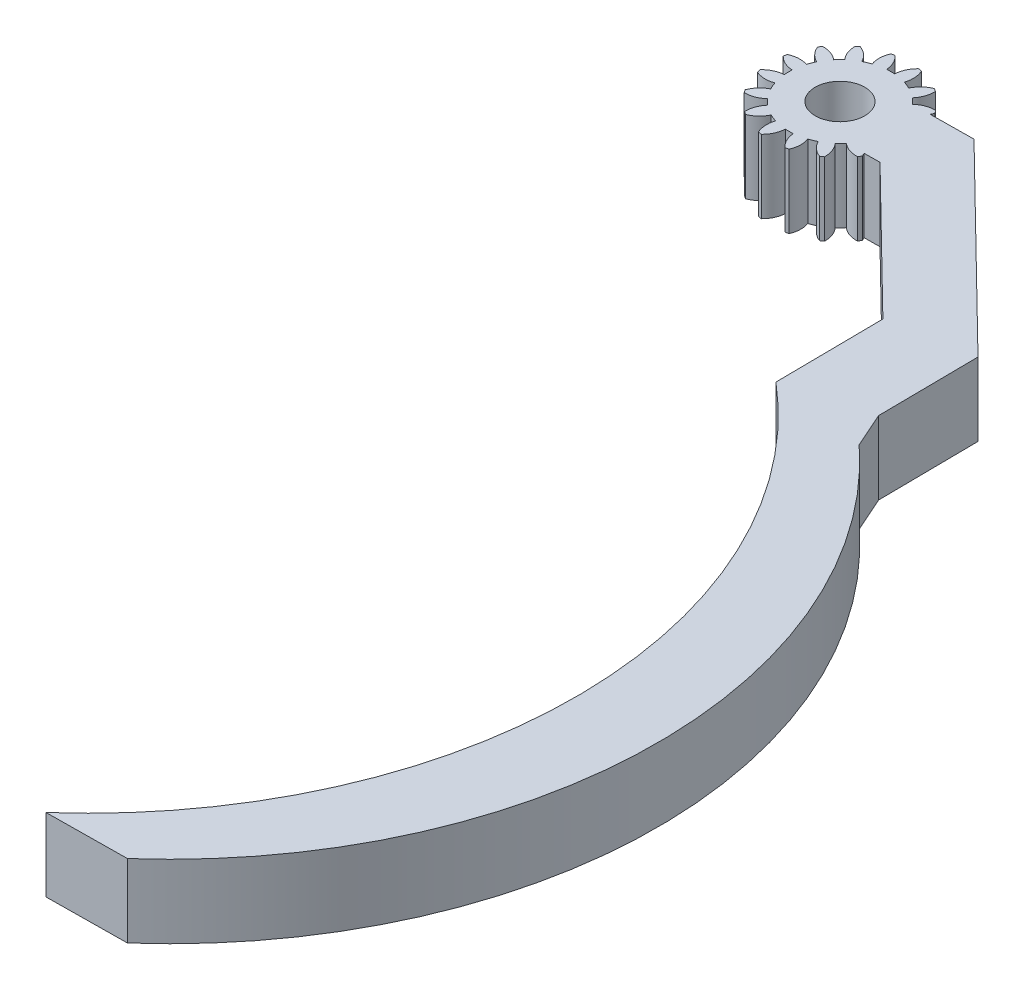
from build123d import *

# Parameters (mm, degrees)
SKETCH1_R           = 2.585044133
BOSS_EXTRUDE1_DEPTH = 7.62


with BuildPart() as part:
    # Sketch1 → Boss-Extrude1 (new body)
    with BuildSketch(Plane(origin=(0, 0, 0), x_dir=(1, 0, 0), z_dir=(0, 1, 0))):
        with BuildLine():
            Line((-58.744472787, 21.18875714), (-58.863577215, 32.44818208))
            Line((-58.863577215, 32.44818208), (-73.152298059, 46.437769379))
            Line((-73.152298059, 46.437769379), (-74.797762466, 46.42036333))
            ThreePointArc((-74.797762466, 46.42036333), (-74.712288392, 46.256361266), (-74.638974072, 46.086574622))
            ThreePointArc((-74.638974072, 46.086574622), (-74.738493774, 45.929751081), (-74.84205687, 45.775567815))
            ThreePointArc((-74.84205687, 45.775567815), (-75.79237137, 45.916884294), (-76.622213572, 46.401063925))
            ThreePointArc((-76.622213572, 46.401063925), (-76.899486556, 46.095069224), (-77.199547344, 45.811385265))
            ThreePointArc((-77.199547344, 45.811385265), (-76.697921552, 44.991971107), (-76.536533716, 44.044858674))
            ThreePointArc((-76.536533716, 44.044858674), (-76.688491702, 43.938057155), (-76.843174908, 43.835242273))
            ThreePointArc((-76.843174908, 43.835242273), (-77.667071549, 44.32947129), (-78.248458251, 45.094361803))
            ThreePointArc((-78.248458251, 45.094361803), (-78.621724189, 44.917767339), (-79.00750536, 44.770505828))
            ThreePointArc((-79.00750536, 44.770505828), (-78.857639781, 43.82150198), (-79.070981099, 42.884723736))
            ThreePointArc((-79.070981099, 42.884723736), (-79.252243144, 42.844203803), (-79.434497344, 42.808409938))
            ThreePointArc((-79.434497344, 42.808409938), (-80.00654533, 43.580309605), (-80.250965679, 44.509463354))
            ThreePointArc((-80.250965679, 44.509463354), (-80.663398214, 44.489154033), (-81.076168083, 44.5007342))
            ThreePointArc((-81.076168083, 44.5007342), (-81.300878392, 43.566617894), (-81.856469582, 42.782789835))
            ThreePointArc((-81.856469582, 42.782789835), (-82.039440183, 42.81472028), (-82.221518827, 42.851396724))
            ThreePointArc((-82.221518827, 42.851396724), (-82.454629039, 43.783452315), (-82.32487225, 44.735414064))
            ThreePointArc((-82.32487225, 44.735414064), (-82.713682269, 44.874481796), (-83.090600365, 45.043140665))
            ThreePointArc((-83.090600365, 45.043140665), (-83.655676454, 44.266122641), (-84.468933795, 43.754575485))
            ThreePointArc((-84.468933795, 43.754575485), (-84.625757336, 43.854095187), (-84.779940601, 43.957658283))
            ThreePointArc((-84.779940601, 43.957658283), (-84.638624122, 44.907972782), (-84.154444491, 45.737814985))
            ThreePointArc((-84.154444491, 45.737814985), (-84.460439193, 46.015087969), (-84.744123152, 46.315148756))
            ThreePointArc((-84.744123152, 46.315148756), (-85.563537309, 45.813522965), (-86.510649743, 45.652135128))
            ThreePointArc((-86.510649743, 45.652135128), (-86.617451261, 45.804093115), (-86.720266143, 45.958776321))
            ThreePointArc((-86.720266143, 45.958776321), (-86.226037126, 46.782672961), (-85.461146613, 47.364059664))
            ThreePointArc((-85.461146613, 47.364059664), (-85.637741078, 47.737325602), (-85.785002589, 48.123106773))
            ThreePointArc((-85.785002589, 48.123106773), (-86.734006437, 47.973241194), (-87.670784681, 48.186582511))
            ThreePointArc((-87.670784681, 48.186582511), (-87.711304614, 48.367844557), (-87.747098479, 48.550098756))
            ThreePointArc((-87.747098479, 48.550098756), (-86.975198811, 49.122146743), (-86.046045062, 49.366567091))
            ThreePointArc((-86.046045062, 49.366567091), (-86.066354384, 49.778999627), (-86.054774217, 50.191769496))
            ThreePointArc((-86.054774217, 50.191769496), (-86.988890523, 50.416479804), (-87.772718581, 50.972070995))
            ThreePointArc((-87.772718581, 50.972070995), (-87.740788136, 51.155041596), (-87.704111693, 51.33712024))
            ThreePointArc((-87.704111693, 51.33712024), (-86.772056102, 51.570230452), (-85.820094353, 51.440473663))
            ThreePointArc((-85.820094353, 51.440473663), (-85.681026621, 51.829283682), (-85.512367752, 52.206201778))
            ThreePointArc((-85.512367752, 52.206201778), (-86.289385775, 52.771277867), (-86.800932932, 53.584535208))
            ThreePointArc((-86.800932932, 53.584535208), (-86.701413229, 53.741358749), (-86.597850134, 53.895542014))
            ThreePointArc((-86.597850134, 53.895542014), (-85.647535634, 53.754225535), (-84.817693432, 53.270045904))
            ThreePointArc((-84.817693432, 53.270045904), (-84.540420448, 53.576040606), (-84.24035966, 53.859724565))
            ThreePointArc((-84.24035966, 53.859724565), (-84.741985451, 54.679138722), (-84.903373288, 55.626251155))
            ThreePointArc((-84.903373288, 55.626251155), (-84.751415301, 55.733052674), (-84.596732096, 55.835867556))
            ThreePointArc((-84.596732096, 55.835867556), (-83.772835455, 55.341638539), (-83.191448752, 54.576748026))
            ThreePointArc((-83.191448752, 54.576748026), (-82.818182815, 54.75334249), (-82.432401643, 54.900604001))
            ThreePointArc((-82.432401643, 54.900604001), (-82.582267223, 55.84960785), (-82.368925905, 56.786386093))
            ThreePointArc((-82.368925905, 56.786386093), (-82.18766386, 56.826906026), (-82.00540966, 56.862699892))
            ThreePointArc((-82.00540966, 56.862699892), (-81.433361673, 56.090800224), (-81.188941325, 55.161646475))
            ThreePointArc((-81.188941325, 55.161646475), (-80.77650879, 55.181955796), (-80.363738921, 55.17037563))
            ThreePointArc((-80.363738921, 55.17037563), (-80.139028612, 56.104491936), (-79.583437422, 56.888319994))
            ThreePointArc((-79.583437422, 56.888319994), (-79.400466821, 56.856389549), (-79.218388177, 56.819713106))
            ThreePointArc((-79.218388177, 56.819713106), (-78.985277965, 55.887657515), (-79.115034753, 54.935695766))
            ThreePointArc((-79.115034753, 54.935695766), (-78.726224734, 54.796628034), (-78.349306639, 54.627969164))
            ThreePointArc((-78.349306639, 54.627969164), (-77.78423055, 55.404987188), (-76.970973209, 55.916534344))
            ThreePointArc((-76.970973209, 55.916534344), (-76.814149668, 55.817014642), (-76.659966403, 55.713451547))
            ThreePointArc((-76.659966403, 55.713451547), (-76.801282881, 54.763137047), (-77.285462512, 53.933294844))
            ThreePointArc((-77.285462512, 53.933294844), (-76.979467811, 53.656021861), (-76.695783852, 53.355961073))
            ThreePointArc((-76.695783852, 53.355961073), (-75.876369695, 53.857586864), (-74.929257261, 54.018974701))
            ThreePointArc((-74.929257261, 54.018974701), (-74.822455743, 53.867016714), (-74.71964086, 53.712333509))
            ThreePointArc((-74.71964086, 53.712333509), (-74.789347103, 53.541033964), (-74.871332746, 53.375260478))
            Line((-74.871332746, 53.375260478), (-70.346139099, 53.423128873))
            Line((-70.346139099, 53.423128873), (-50.484046566, 33.9768481))
            Line((-50.484046566, 33.9768481), (-50.373431547, 23.519961391))
            Line((-50.373431547, 23.519961391), (-48.757825737, 19.872187168))
            ThreePointArc((-48.757825737, 19.872187168), (-32.369822631, -18.023926027), (-49.536764273, -55.573601869))
            Line((-49.536764273, -55.573601869), (-57.931525987, -55.662403321))
            ThreePointArc((-57.931525987, -55.662403321), (-40.764719029, -17.050929449), (-58.744472787, 21.18875714))
        make_face()
        with Locations(Location((-80.719953502, 49.835554915, 0), (0, 0, 90))):
            Circle(SKETCH1_R, mode=Mode.SUBTRACT)
    extrude(amount=BOSS_EXTRUDE1_DEPTH)


solid = part.part
